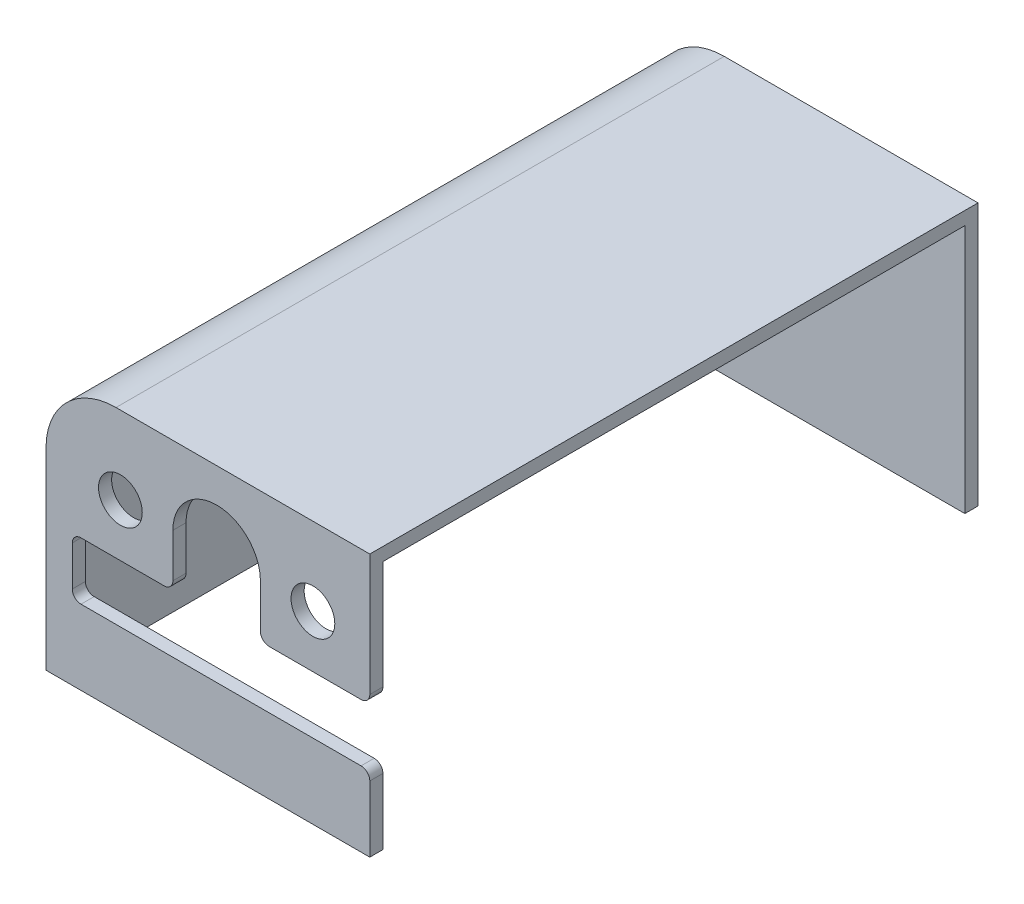
from build123d import *

# Parameters (mm, degrees)
BOSS_EXTRUDE1_DEPTH     = 15
CUT_EXTRUDE1_DEPTH      = 45.432533126
CUT_EXTRUDE1_DEPTH_BACK = 45.432533126
SKETCH3_W               = 35.5
SKETCH3_H               = 1.5
BOSS_EXTRUDE2_DEPTH     = 15
BOSS_EXTRUDE3_DEPTH     = 13.5
SKETCH5_W               = 37
SKETCH5_H               = 69.5
BOSS_EXTRUDE4_DEPTH     = 1.5
FILLET1_R               = 8
SKETCH6_R               = 2.5
CUT_EXTRUDE2_DEPTH      = 1.5
FILLET2_R               = 1
CUT_EXTRUDE3_DEPTH      = 61.3158354
CUT_EXTRUDE3_DEPTH_BACK = 61.3158354
SKETCH7_R               = 0.75


with BuildPart() as part:
    # Sketch1 → Boss-Extrude1 (new body)
    with BuildSketch(Plane(origin=(0, 0, 0), x_dir=(1, 0, 0), z_dir=(0, 1, 0))):
        Polygon((17.5, 35.5), (-18, 35.5), (-18, -35.5), (17.5, -35.5), (17.5, -37), (-19.5, -37), (-19.5, 37), (17.5, 37), align=None)
    extrude(amount=BOSS_EXTRUDE1_DEPTH)

    # Sketch2 → Cut-Extrude1 (cut, two sides: drawn at the far end of the back side and taken through both)
    with BuildSketch(Plane(origin=(0, 15, 0), x_dir=(1, 0, 0), z_dir=(0, 1, 0)).offset(-CUT_EXTRUDE1_DEPTH_BACK)):
        Polygon((17.5, -35.5), (17.5, -37), (28.422753275, -37), (28.422753275, -32.5), (-18, -32.5), (-18, -35.5), align=None)
        Polygon((-19.5, -32.5), (-19.5, -37), (17.5, -37), (17.5, -35.5), (-18, -35.5), (-18, -32.5), align=None)
    extrude(amount=CUT_EXTRUDE1_DEPTH + CUT_EXTRUDE1_DEPTH_BACK, mode=Mode.SUBTRACT)

    # Sketch3 → Boss-Extrude2 (add)
    with BuildSketch(Plane(origin=(0, 15, 0), x_dir=(1, 0, 0), z_dir=(0, 1, 0))):
        with Locations((-0.25, -31.75)):
            Rectangle(SKETCH3_W, SKETCH3_H)
    extrude(amount=-BOSS_EXTRUDE2_DEPTH)

    # Sketch4 → Boss-Extrude3 (add)
    with BuildSketch(Plane(origin=(0, 15, 0), x_dir=(1, 0, 0), z_dir=(0, 1, 0))):
        Polygon((-19.5, -32.5), (17.5, -32.5), (17.5, -31), (-18, -31), (-18, 35.5), (17.5, 35.5), (17.5, 37), (-19.5, 37), align=None)
    extrude(amount=BOSS_EXTRUDE3_DEPTH)

    # Sketch5 → Boss-Extrude4 (add)
    with BuildSketch(Plane(origin=(0, 28.5, 0), x_dir=(1, 0, 0), z_dir=(0, 1, 0))):
        with Locations((-1, 2.25)):
            Rectangle(SKETCH5_W, SKETCH5_H)
    extrude(amount=BOSS_EXTRUDE4_DEPTH)

    # Fillet1
    fillet1_edges = [part.edges().sort_by_distance(p)[0] for p in [
        (-18, 28.5, -2.25),
        (-19.5, 30, -2.25),
    ]]
    fillet(fillet1_edges, radius=FILLET1_R)

    # Sketch6 → Cut-Extrude2 (cut)
    with BuildSketch(Plane.XY.offset(32.5)):
        with BuildLine():
            Line((-5, 15.1), (-16.5, 15.1))
            Line((-16.5, 15.1), (-16.5, 8.53719171))
            Line((-16.5, 8.53719171), (17.5, 8.53719171))
            Line((17.5, 8.53719171), (17.5, 15.1))
            Line((17.5, 15.1), (5, 15.1))
            Line((5, 15.1), (5, 21.1))
            ThreePointArc((5, 21.1), (0, 26.1), (-5, 21.1))
            Line((-5, 21.1), (-5, 15.1))
        make_face()
        with Locations((-11, 21.1)):
            Circle(SKETCH6_R)
        with Locations((11, 21.1)):
            Circle(SKETCH6_R)
    extrude(amount=-CUT_EXTRUDE2_DEPTH, mode=Mode.SUBTRACT)

    # Fillet2
    fillet2_edges = [part.edges().sort_by_distance(p)[0] for p in [
        (5, 15.1, 31.75),
        (17.5, 15.1, 31.75),
        (17.5, 8.53719171, 31.75),
        (-16.5, 8.53719171, 31.75),
        (-16.5, 15.1, 31.75),
        (-5, 15.1, 31.75),
    ]]
    fillet(fillet2_edges, radius=FILLET2_R)

    # Sketch7 → Cut-Extrude3 (cut, two sides: drawn at the far end of the back side and taken through both)
    with BuildSketch(Plane.ZY.offset(19.5).offset(-CUT_EXTRUDE3_DEPTH_BACK)):
        with Locations((25, 1.5)):
            Circle(SKETCH7_R)
        with Locations((0, 1.5)):
            Circle(SKETCH7_R)
        with Locations((-25, 1.5)):
            Circle(SKETCH7_R)
    extrude(amount=CUT_EXTRUDE3_DEPTH + CUT_EXTRUDE3_DEPTH_BACK, mode=Mode.SUBTRACT)


solid = part.part
